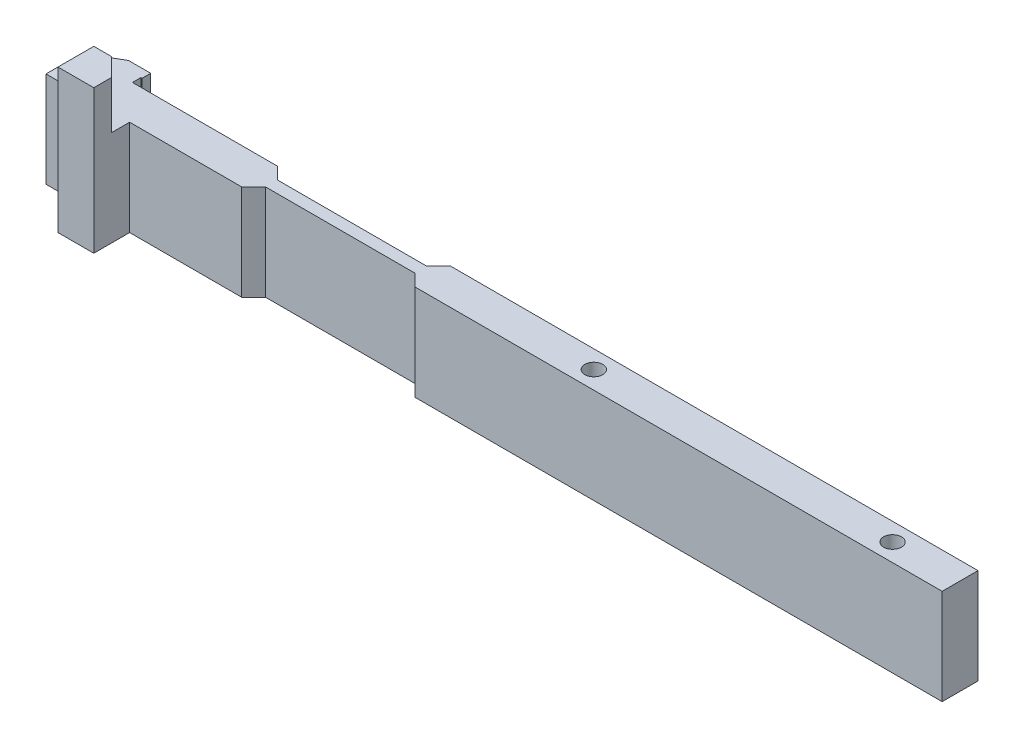
from build123d import *

# Parameters (mm, degrees)
EXTRUDE_1_DEPTH     = 16
SKETCH_3_R          = 1.5
CUT_EXTRUDE_1_DEPTH = 82.804645345
SKETCH_4_W          = 6
SKETCH_4_H          = 6
EXTRUDE_2_DEPTH     = 16
EXTRUDE_3_DEPTH     = 8


with BuildPart() as part:
    # Эскиз1 → Бобышка-Вытянуть1 (new body)
    with BuildSketch(Plane(origin=(0, 0, 0), x_dir=(1, 0, 0), z_dir=(0, 1, 0))):
        Polygon((0, 0), (-71.525936721, 0), (-71.525936721, 1.396480231), (-71.325936721, 1.396480231), (-71.325936721, 2.8586364), (-75.035652424, 2.8586364), (-80, -0.007531009), (-80, -6), (70, -6), (70, 0), align=None)
    extrude(amount=EXTRUDE_1_DEPTH)

    # Эскиз3 → Вырез-Вытянуть1 (cut, through all)
    with BuildSketch(Plane(origin=(0, 16, 0), x_dir=(1, 0, 0), z_dir=(0, 1, 0))):
        with Locations(Location((8.699103215, -3.003765504, 0), (0, 0, 270))):
            Circle(SKETCH_3_R)
        with Locations(Location((58.699103215, -3.003765504, 0), (0, 0, 270))):
            Circle(SKETCH_3_R)
        Polygon((-47.243192472, 0), (-45.239426968, -2.003765504), (-20.270391363, -2.003765504), (-18.266625858, 0), align=None)
        Polygon((-47.243192472, -6.007531009), (-18.266625858, -6.007531009), (-20.270391363, -4.003765504), (-45.239426968, -4.003765504), align=None)
    extrude(amount=-CUT_EXTRUDE_1_DEPTH, mode=Mode.SUBTRACT)

    # Эскиз4 → Бобышка-Вытянуть2 (add)
    with BuildSketch(Plane.XZ):
        with Locations((-69, 9)):
            Rectangle(SKETCH_4_W, SKETCH_4_H)
    extrude(amount=-EXTRUDE_2_DEPTH)

    # Эскиз5 → Бобышка-Вытянуть3 (add)
    with BuildSketch(Plane(origin=(0, 16, 0), x_dir=(1, 0, 0), z_dir=(0, 1, 0))):
        Polygon((-72, -12), (-72, -6), (-69, -6), (-66, -9), (-66, -12), align=None)
    extrude(amount=EXTRUDE_3_DEPTH)


solid = part.part
